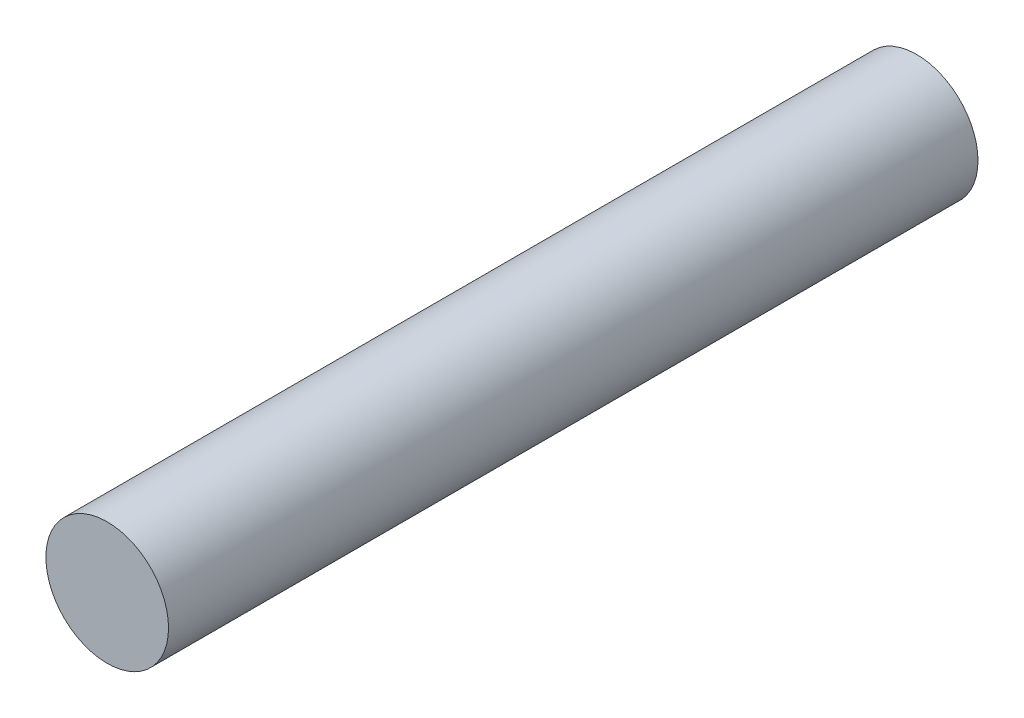
from build123d import *

# Parameters (mm, degrees)
SKETCH1_R           = 2.5
BOSS_EXTRUDE1_DEPTH = 33


with BuildPart() as part:
    # Sketch1 → Boss-Extrude1 (new body)
    with BuildSketch(Plane.XY):
        Circle(SKETCH1_R)
    extrude(amount=BOSS_EXTRUDE1_DEPTH)


solid = part.part
